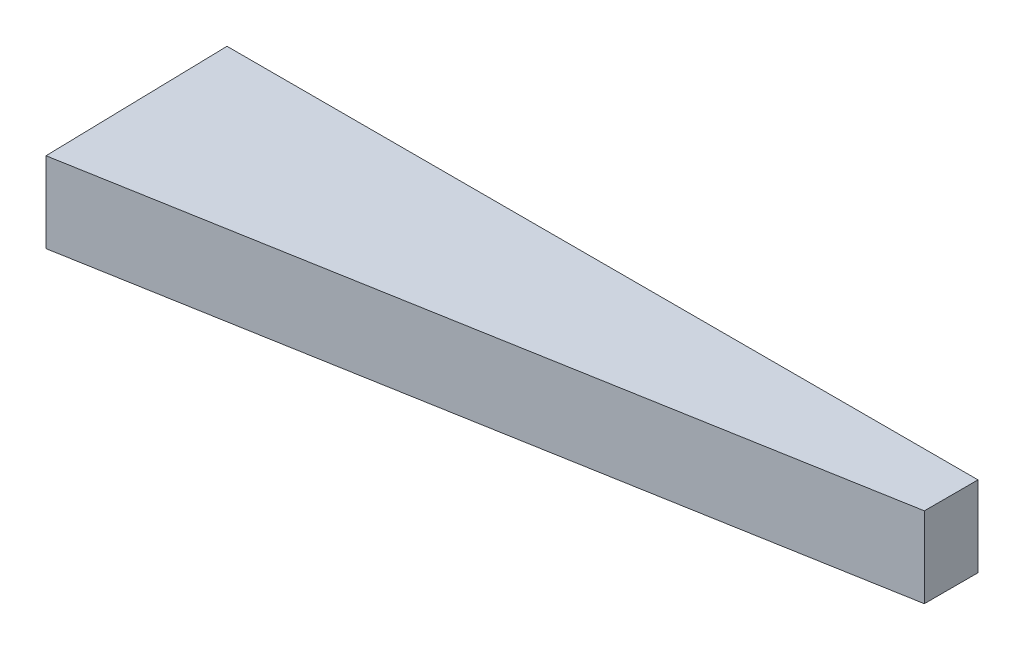
from build123d import *

# Parameters (mm, degrees)
BOSS_EXTRUDE1_DEPTH = 19.05


with BuildPart() as part:
    # Sketch1 → Boss-Extrude1 (new body)
    with BuildSketch(Plane(origin=(0, 0, 0), x_dir=(1, 0, 0), z_dir=(0, 1, 0))):
        Polygon((0, 0), (177.8, 0), (177.8, -12.7), (1.016953795, -43.871620778), align=None)
    extrude(amount=BOSS_EXTRUDE1_DEPTH)


solid = part.part
